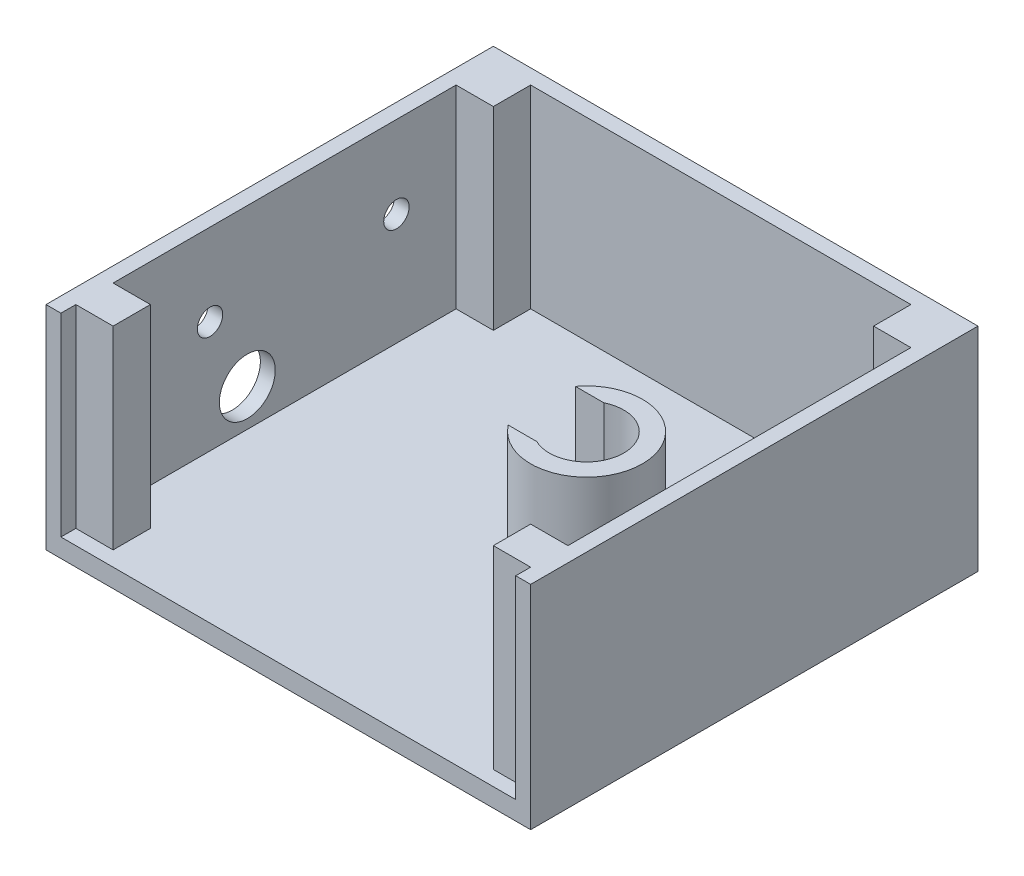
from build123d import *

# Parameters (mm, degrees)
SKETCH4_W           = 130
SKETCH4_H           = 120
BOSS_EXTRUDE1_DEPTH = 5
BOSS_EXTRUDE2_DEPTH = 52
SKETCH6_W           = 10
SKETCH6_H           = 10
BOSS_EXTRUDE3_DEPTH = 52
SKETCH7_R           = 7.5
CUT_EXTRUDE1_DEPTH  = 5
SKETCH8_R           = 15
SKETCH8_R_2         = 10
BOSS_EXTRUDE4_DEPTH = 30
BOSS_EXTRUDE5_DEPTH = 10
SKETCH10_W          = 15
SKETCH10_H          = 18
CUT_EXTRUDE2_DEPTH  = 30
SKETCH11_R          = 3.41
CUT_EXTRUDE3_DEPTH  = 5


with BuildPart() as part:
    # Sketch4 → Boss-Extrude1 (new body)
    with BuildSketch(Plane(origin=(0, 0, 0), x_dir=(1, 0, 0), z_dir=(0, 1, 0))):
        Rectangle(SKETCH4_W, SKETCH4_H)
    extrude(amount=BOSS_EXTRUDE1_DEPTH)

    # Sketch5 → Boss-Extrude2 (add)
    with BuildSketch(Plane(origin=(0, 5, 0), x_dir=(1, 0, 0), z_dir=(0, 1, 0))):
        Polygon((-65, -60), (-65, 60), (65, 60), (65, -60), (61, -60), (61, 56), (-61, 56), (-61, -60), align=None)
    extrude(amount=BOSS_EXTRUDE2_DEPTH)

    # Sketch6 → Boss-Extrude3 (add)
    with BuildSketch(Plane(origin=(0, 5, 0), x_dir=(1, 0, 0), z_dir=(0, 1, 0))):
        with Locations((-56, 51)):
            Rectangle(SKETCH6_W, SKETCH6_H)
        with Locations((56, 51)):
            Rectangle(SKETCH6_W, SKETCH6_H)
        with Locations((56, -51)):
            Rectangle(SKETCH6_W, SKETCH6_H)
        with Locations((-56, -51)):
            Rectangle(SKETCH6_W, SKETCH6_H)
    extrude(amount=BOSS_EXTRUDE3_DEPTH)

    # Sketch7 → Cut-Extrude1 (cut)
    with BuildSketch(Plane.ZY.offset(65)):
        with Locations((10, 15)):
            Circle(SKETCH7_R)
    extrude(amount=-CUT_EXTRUDE1_DEPTH, mode=Mode.SUBTRACT)

    # Sketch8 → Boss-Extrude4 (add)
    with BuildSketch(Plane(origin=(0, 5, 0), x_dir=(1, 0, 0), z_dir=(0, 1, 0))):
        with Locations(Location((15, 5, 0), (0, 0, 90))):
            Circle(SKETCH8_R)
        with Locations(Location((15, 5, 0), (0, 0, 270))):
            Circle(SKETCH8_R_2, mode=Mode.SUBTRACT)
    extrude(amount=BOSS_EXTRUDE4_DEPTH)

    # Sketch9 → Boss-Extrude5 (add)
    with BuildSketch(Plane(origin=(0, 5, 0), x_dir=(1, 0, 0), z_dir=(0, 1, 0))):
        with BuildLine():
            Line((14, -4), (14, -5.590084182))
            Line((14, -5.590084182), (16, -5.590084182))
            Line((16, -5.590084182), (16, -4))
            ThreePointArc((16, -4), (15, -3), (14, -4))
        make_face()
        with BuildLine():
            Line((14, 14), (14, 15.761522781))
            Line((14, 15.761522781), (16, 15.761522781))
            Line((16, 15.761522781), (16, 14))
            ThreePointArc((16, 14), (15, 13), (14, 14))
        make_face()
    extrude(amount=BOSS_EXTRUDE5_DEPTH)

    # Sketch10 → Cut-Extrude2 (cut)
    with BuildSketch(Plane(origin=(0, 35, 0), x_dir=(1, 0, 0), z_dir=(0, 1, 0))):
        with Locations((5.5, 5)):
            Rectangle(SKETCH10_W, SKETCH10_H)
    extrude(amount=-CUT_EXTRUDE2_DEPTH, mode=Mode.SUBTRACT)

    # Sketch11 → Cut-Extrude3 (cut)
    with BuildSketch(Plane.ZY.offset(65)):
        with Locations((-30, 35)):
            Circle(SKETCH11_R)
        with Locations((20, 35)):
            Circle(SKETCH11_R)
    extrude(amount=-CUT_EXTRUDE3_DEPTH, mode=Mode.SUBTRACT)


solid = part.part
